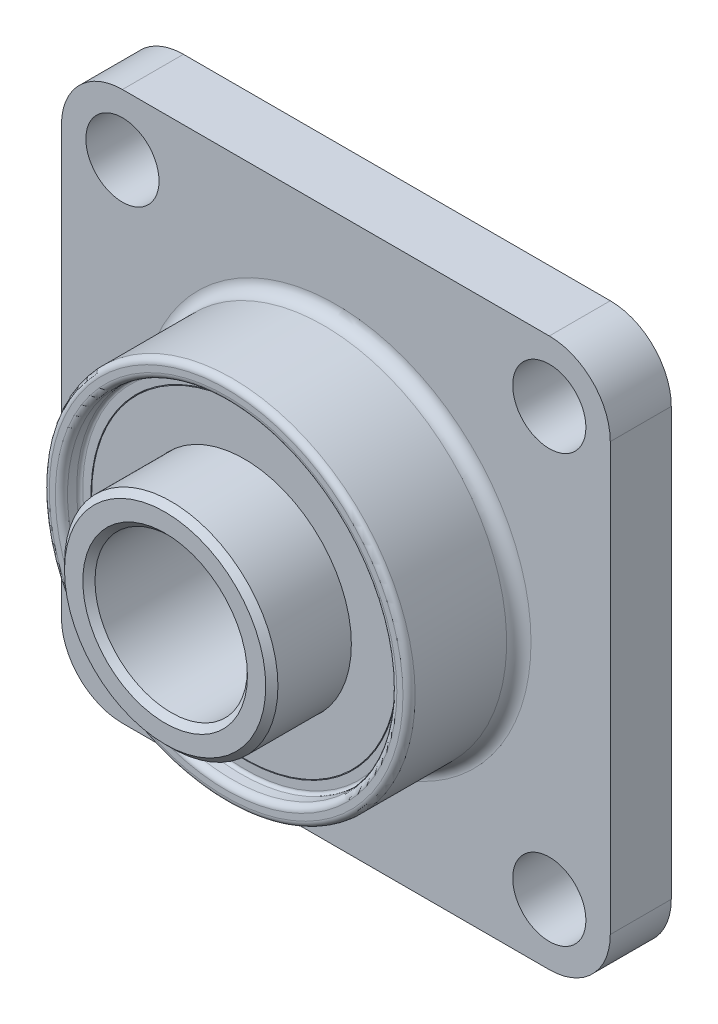
from build123d import *

# Parameters (mm, degrees)
SKETCH1_R           = 6
SKETCH1_R_2         = 24
BOSS_EXTRUDE1_DEPTH = 10
SKETCH2_R           = 30
SKETCH2_R_2         = 27
BOSS_EXTRUDE2_DEPTH = 18
FILLET1_R           = 2
SKETCH3_R           = 27.154323103
SKETCH3_R_2         = 25.154323103
BOSS_EXTRUDE3_DEPTH = 15
FILLET2_R           = 1
SKETCH4_R           = 25.041805443
SKETCH4_R_2         = 23.541805443
BOSS_EXTRUDE4_DEPTH = 15
FILLET3_R           = 0.5
SKETCH5_R           = 23.541805443
SKETCH5_R_2         = 17.541805443
BOSS_EXTRUDE5_DEPTH = 15
SKETCH6_R           = 17.5
SKETCH6_R_2         = 12.5
BOSS_EXTRUDE6_DEPTH = 28
CUT_EXTRUDE2_DEPTH  = 6
SKETCH9_R           = 17.5
SKETCH9_R_2         = 12.5
BOSS_EXTRUDE7_DEPTH = 10
CHAMFER1_SIZE       = 1
CHAMFER2_SIZE       = 1


with BuildPart() as part:
    # Sketch1 → Boss-Extrude1 (new body)
    with BuildSketch(Plane.XY):
        with BuildLine():
            Line((-35, -45), (35, -45))
            ThreePointArc((35, -45), (42.071067812, -42.071067812), (45, -35))
            Line((45, -35), (45, 35))
            ThreePointArc((45, 35), (42.071067812, 42.071067812), (35, 45))
            Line((35, 45), (-35, 45))
            ThreePointArc((-35, 45), (-42.071067812, 42.071067812), (-45, 35))
            Line((-45, 35), (-45, -35))
            ThreePointArc((-45, -35), (-42.071067812, -42.071067812), (-35, -45))
        make_face()
        with Locations((-35, 35)):
            Circle(SKETCH1_R, mode=Mode.SUBTRACT)
        with Locations((35, 35)):
            Circle(SKETCH1_R, mode=Mode.SUBTRACT)
        with Locations((35, -35)):
            Circle(SKETCH1_R, mode=Mode.SUBTRACT)
        with Locations((-35, -35)):
            Circle(SKETCH1_R, mode=Mode.SUBTRACT)
        Circle(SKETCH1_R_2, mode=Mode.SUBTRACT)
    extrude(amount=BOSS_EXTRUDE1_DEPTH)

    # Sketch2 → Boss-Extrude2 (add)
    with BuildSketch(Plane.XY.offset(10)):
        with Locations(Location((0, 0, 0), (0, 0, 180))):
            Circle(SKETCH2_R)
        Circle(SKETCH2_R_2, mode=Mode.SUBTRACT)
    extrude(amount=BOSS_EXTRUDE2_DEPTH)

    # Fillet1
    fillet1_edges = [part.edges().sort_by_distance(p)[0] for p in [
        (30, 0, 10),
    ]]
    fillet(fillet1_edges, radius=FILLET1_R)

    # Sketch3 → Boss-Extrude3 (add)
    with BuildSketch(Plane.XY.offset(10)):
        Circle(SKETCH3_R)
        Circle(SKETCH3_R_2, mode=Mode.SUBTRACT)
    extrude(amount=BOSS_EXTRUDE3_DEPTH)

    # Fillet2
    fillet2_edges = [part.edges().sort_by_distance(p)[0] for p in [
        (30, 0, 28),
        (-27, 0, 28),
    ]]
    fillet(fillet2_edges, radius=FILLET2_R)

    # Sketch4 → Boss-Extrude4 (add)
    with BuildSketch(Plane.XY.offset(10)):
        with Locations(Location((0, 0, 0), (0, 0, 180))):
            Circle(SKETCH4_R)
        Circle(SKETCH4_R_2, mode=Mode.SUBTRACT)
    extrude(amount=BOSS_EXTRUDE4_DEPTH)

    # Fillet3
    fillet3_edges = [part.edges().sort_by_distance(p)[0] for p in [
        (-27, 0, 25),
    ]]
    fillet(fillet3_edges, radius=FILLET3_R)

    # Sketch5 → Boss-Extrude5 (add)
    with BuildSketch(Plane.XY.offset(10)):
        Circle(SKETCH5_R)
        Circle(SKETCH5_R_2, mode=Mode.SUBTRACT)
    extrude(amount=BOSS_EXTRUDE5_DEPTH)

    # Sketch8 → Cut-Extrude2 (cut)
    with BuildSketch(Plane(origin=(0, 0, 0), x_dir=(-1, 0, 0), z_dir=(0, 0, -1))):
        with BuildLine():
            Line((23.686291501, -39), (-23.686291501, -39))
            ThreePointArc((-23.686291501, -39), (-26.514718626, -26.514718626), (-39, -23.686291501))
            Line((-39, -23.686291501), (-39, 23.686291501))
            ThreePointArc((-39, 23.686291501), (-26.514718626, 26.514718626), (-23.686291501, 39))
            Line((-23.686291501, 39), (23.686291501, 39))
            ThreePointArc((23.686291501, 39), (26.514718626, 26.514718626), (39, 23.686291501))
            Line((39, 23.686291501), (39, -23.686291501))
            ThreePointArc((39, -23.686291501), (26.514718626, -26.514718626), (23.686291501, -39))
        make_face()
    extrude(amount=-CUT_EXTRUDE2_DEPTH, mode=Mode.SUBTRACT)


with BuildPart() as body_2:
    # Sketch6 → Boss-Extrude6 (new body)
    with BuildSketch(Plane.XY.offset(10)):
        Circle(SKETCH6_R)
        Circle(SKETCH6_R_2, mode=Mode.SUBTRACT)
    extrude(amount=BOSS_EXTRUDE6_DEPTH)

    # Sketch9 → Boss-Extrude7 (add)
    with BuildSketch(Plane(origin=(0, 0, 10), x_dir=(-1, 0, 0), z_dir=(0, 0, -1))):
        Circle(SKETCH9_R)
        Circle(SKETCH9_R_2, mode=Mode.SUBTRACT)
    extrude(amount=BOSS_EXTRUDE7_DEPTH)

    # Chamfer1
    chamfer1_edges = [body_2.edges().sort_by_distance(p)[0] for p in [
        (-17.5, 0, 38),
        (-12.5, 0, 38),
    ]]
    chamfer(chamfer1_edges, length=CHAMFER1_SIZE)

    # Chamfer2
    chamfer2_edges = [body_2.edges().sort_by_distance(p)[0] for p in [
        (12.5, 0, 0),
        (17.5, 0, 0),
    ]]
    chamfer(chamfer2_edges, length=CHAMFER2_SIZE)


solid = Compound([part.part, body_2.part])
